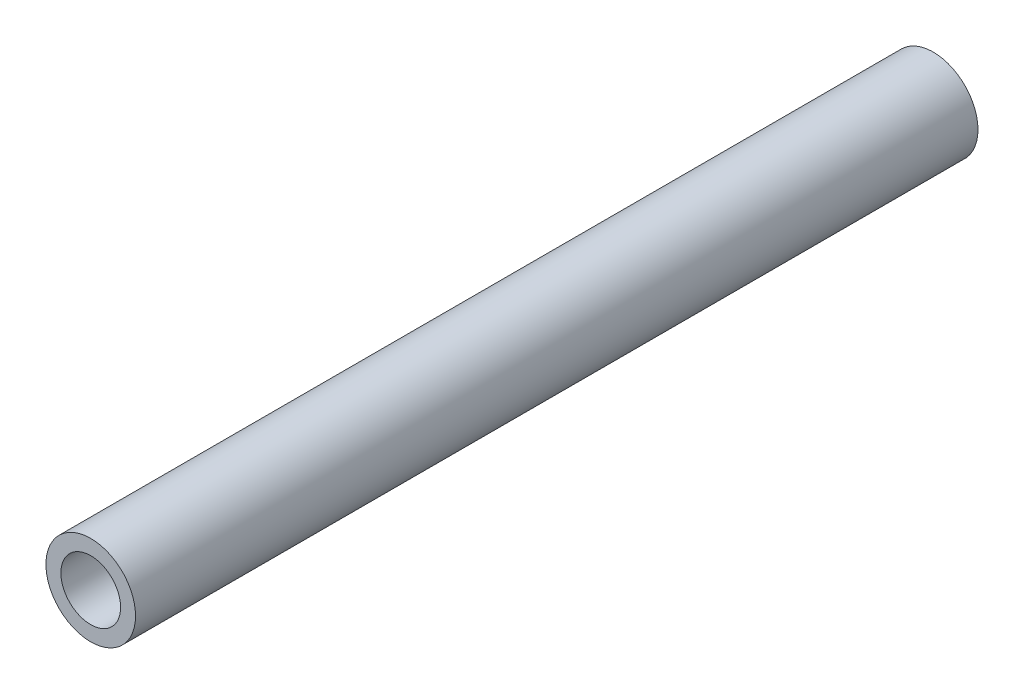
from build123d import *

# Parameters (mm, degrees)
SCHIZZO1_R                   = 3
SCHIZZO1_R_2                 = 2
ESTRUSIONE_ESTRUSIONE1_DEPTH = 56.4


with BuildPart() as part:
    # Schizzo1 → Estrusione-Estrusione1 (new body)
    with BuildSketch(Plane.XY):
        Circle(SCHIZZO1_R)
        Circle(SCHIZZO1_R_2, mode=Mode.SUBTRACT)
    extrude(amount=ESTRUSIONE_ESTRUSIONE1_DEPTH)


solid = part.part
